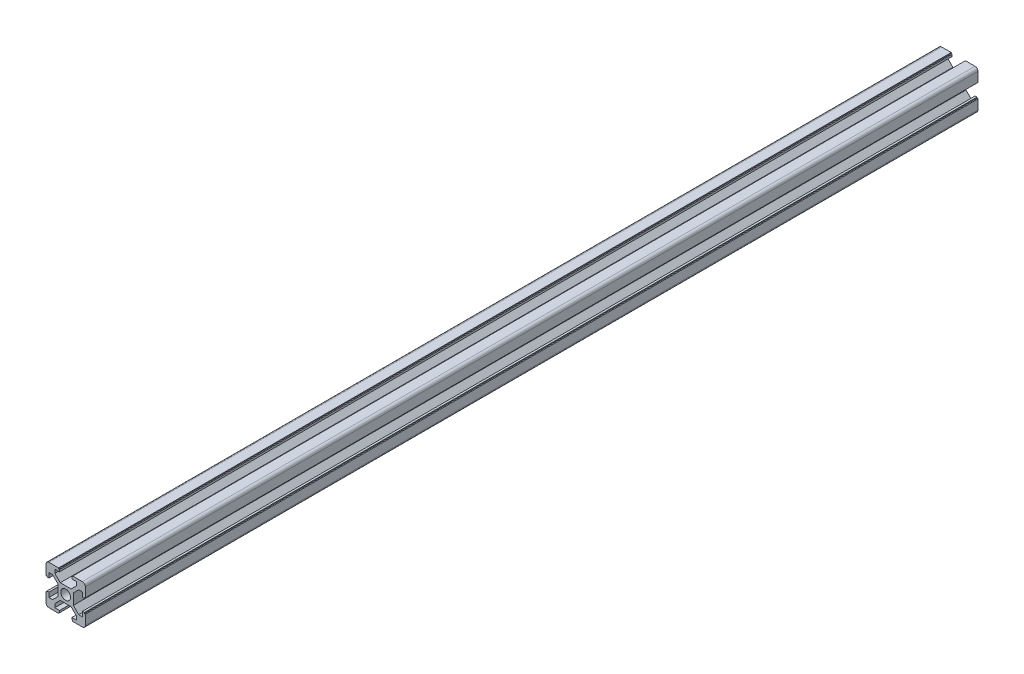
from build123d import *

# Parameters (mm, degrees)
SKETCH1_R       = 2.5
EXTRUDE_1_DEPTH = 454


with BuildPart() as part:
    # Sketch1 → 凸台-拉伸1 (new body)
    with BuildSketch(Plane.XY):
        with BuildLine():
            Line((-3.6, 10), (-3.6, 9.5))
            Line((-3.6, 9.5), (-3.1, 9.5))
            Line((-3.1, 9.5), (-3.1, 8.5))
            Line((-3.1, 8.5), (-5.5, 8.5))
            Line((-5.5, 8.5), (-5.5, 6.65))
            Line((-5.5, 6.65), (-2.75, 3.9))
            Line((-2.75, 3.9), (2.75, 3.9))
            Line((2.75, 3.9), (5.5, 6.65))
            Line((5.5, 6.65), (5.5, 8.5))
            Line((5.5, 8.5), (3.1, 8.5))
            Line((3.1, 8.5), (3.1, 9.5))
            Line((3.1, 9.5), (3.6, 9.5))
            Line((3.6, 9.5), (3.6, 10))
            Line((3.6, 10), (8.5, 10))
            ThreePointArc((8.5, 10), (9.560660172, 9.560660172), (10, 8.5))
            Line((10, 8.5), (10, 3.6))
            Line((10, 3.6), (9.5, 3.6))
            Line((9.5, 3.6), (9.5, 3.1))
            Line((9.5, 3.1), (8.5, 3.1))
            Line((8.5, 3.1), (8.5, 5.5))
            Line((8.5, 5.5), (6.65, 5.5))
            Line((6.65, 5.5), (3.9, 2.75))
            Line((3.9, 2.75), (3.9, -2.75))
            Line((3.9, -2.75), (6.65, -5.5))
            Line((6.65, -5.5), (8.5, -5.5))
            Line((8.5, -5.5), (8.5, -3.1))
            Line((8.5, -3.1), (9.5, -3.1))
            Line((9.5, -3.1), (9.5, -3.6))
            Line((9.5, -3.6), (10, -3.6))
            Line((10, -3.6), (10, -8.5))
            ThreePointArc((10, -8.5), (9.560660172, -9.560660172), (8.5, -10))
            Line((8.5, -10), (3.6, -10))
            Line((3.6, -10), (3.6, -9.5))
            Line((3.6, -9.5), (3.1, -9.5))
            Line((3.1, -9.5), (3.1, -8.5))
            Line((3.1, -8.5), (5.5, -8.5))
            Line((5.5, -8.5), (5.5, -6.65))
            Line((5.5, -6.65), (2.75, -3.9))
            Line((2.75, -3.9), (-2.75, -3.9))
            Line((-2.75, -3.9), (-5.5, -6.65))
            Line((-5.5, -6.65), (-5.5, -8.5))
            Line((-5.5, -8.5), (-3.1, -8.5))
            Line((-3.1, -8.5), (-3.1, -9.5))
            Line((-3.1, -9.5), (-3.6, -9.5))
            Line((-3.6, -9.5), (-3.6, -10))
            Line((-3.6, -10), (-8.5, -10))
            ThreePointArc((-8.5, -10), (-9.560660172, -9.560660172), (-10, -8.5))
            Line((-10, -8.5), (-10, -3.6))
            Line((-10, -3.6), (-9.5, -3.6))
            Line((-9.5, -3.6), (-9.5, -3.1))
            Line((-9.5, -3.1), (-8.5, -3.1))
            Line((-8.5, -3.1), (-8.5, -5.5))
            Line((-8.5, -5.5), (-6.65, -5.5))
            Line((-6.65, -5.5), (-3.9, -2.75))
            Line((-3.9, -2.75), (-3.9, 2.75))
            Line((-3.9, 2.75), (-6.65, 5.5))
            Line((-6.65, 5.5), (-8.5, 5.5))
            Line((-8.5, 5.5), (-8.5, 3.1))
            Line((-8.5, 3.1), (-9.5, 3.1))
            Line((-9.5, 3.1), (-9.5, 3.6))
            Line((-9.5, 3.6), (-10, 3.6))
            Line((-10, 3.6), (-10, 8.5))
            ThreePointArc((-10, 8.5), (-9.560660172, 9.560660172), (-8.5, 10))
            Line((-8.5, 10), (-3.6, 10))
        make_face()
        with Locations(Location((0, 0, 0), (0, 0, 180))):
            Circle(SKETCH1_R, mode=Mode.SUBTRACT)
    extrude(amount=EXTRUDE_1_DEPTH)


solid = part.part
